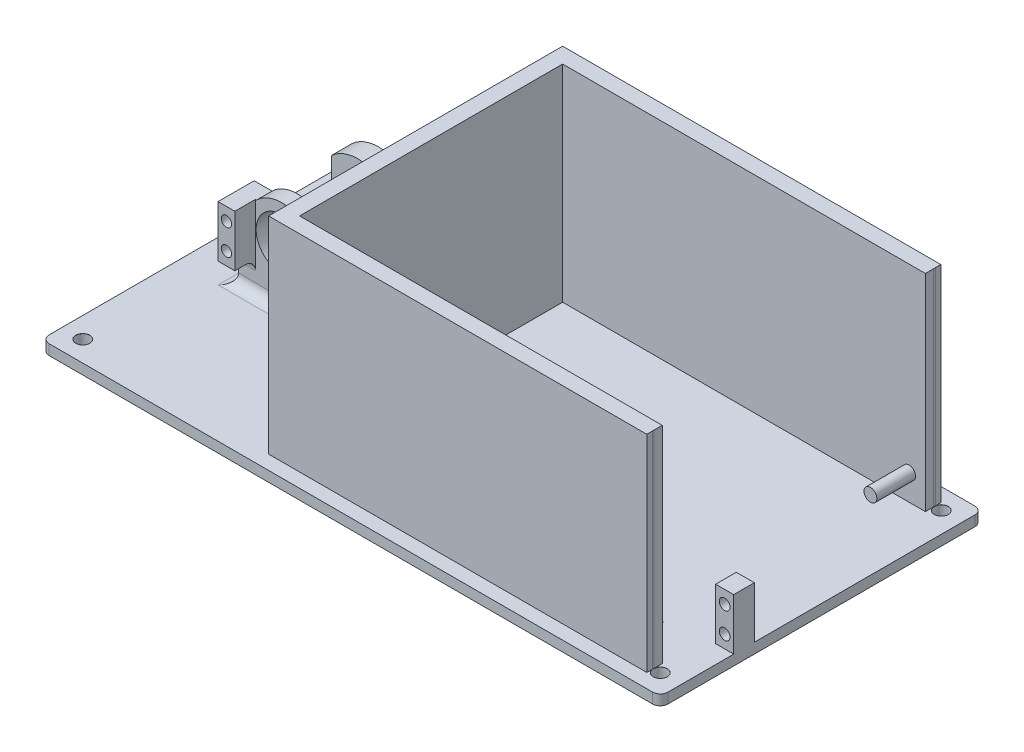
from build123d import *

# Parameters (mm, degrees)
SKETCH_1_W                        = 240
SKETCH_1_H                        = 125
EXTRUDE_1_DEPTH                   = 4
HOLE_WIZARD_5_4_5_4_1_D           = 5.4
HOLE_WIZARD_5_4_5_4_1_CSINK_D     = 5.45
HOLE_WIZARD_5_4_5_4_1_CSINK_ANGLE = 90
FILLET_1_R                        = 3
SKETCH_4_R                        = 10
EXTRUDE_2_DEPTH                   = 6
SKETCH_6_W                        = 6.5
SKETCH_6_H                        = 20
EXTRUDE_3_DEPTH                   = 8
SKETCH_7_R                        = 2
CUT_EXTRUDE_1_DEPTH               = 14
FILLET_2_R                        = 4
FILLET_3_R                        = 4
FILLET_4_R                        = 4
EXTRUDE_START                     = 23.5
EXTRUDE_4_DEPTH                   = 8
SKETCH_9_R                        = 5.5
EXTRUDE_5_DEPTH                   = 5
FILLET_5_R                        = 4
FILLET_6_R                        = 4
SKETCH_12_W                       = 7
SKETCH_12_H                       = 8
EXTRUDE_6_DEPTH                   = 20
CUT_EXTRUDE_2_REACH               = 161.108
SKETCH_13_R                       = 2.1
EXTRUDE_7_DEPTH                   = 80
SKETCH_15_R                       = 2.5
EXTRUDE_8_DEPTH                   = 4
EXTRUDE_START_2                   = 15
SKETCH_17_R                       = 2.5
EXTRUDE_9_DEPTH                   = 15


with BuildPart() as part:
    # 草图1 → 凸台-拉伸1 (new body)
    with BuildSketch(Plane(origin=(0, 0, 0), x_dir=(1, 0, 0), z_dir=(0, 1, 0))):
        Rectangle(SKETCH_1_W, SKETCH_1_H)
    extrude(amount=EXTRUDE_1_DEPTH)

    # Ø5.4 (5.4) 直径孔1 (through all)
    with Locations(Plane(origin=(0, 4, 0), x_dir=(1, 0, 0), z_dir=(0, 1, 0))):
        with Locations((112, 54.5), (-112, 54.5), (-112, -54.5), (112, -54.5)):
            CounterSinkHole(HOLE_WIZARD_5_4_5_4_1_D / 2, HOLE_WIZARD_5_4_5_4_1_CSINK_D / 2, counter_sink_angle=HOLE_WIZARD_5_4_5_4_1_CSINK_ANGLE)

    # 圆角1
    fillet_1_edges = [part.edges().sort_by_distance(p)[0] for p in [
        (120, 2, 62.5),
        (-120, 2, 62.5),
        (-120, 2, -62.5),
        (120, 2, -62.5),
    ]]
    fillet(fillet_1_edges, radius=FILLET_1_R)

    # 草图4 → 凸台-拉伸2 (add)
    with BuildSketch(Plane.XY):
        with BuildLine():
            Line((-100, 4), (-46, 4))
            Line((-46, 4), (-46, 36))
            Line((-46, 36), (-73.452041029, 36))
            ThreePointArc((-73.452041029, 36), (-83.25, 40), (-93.047958971, 36))
            Line((-93.047958971, 36), (-100, 36))
            Line((-100, 36), (-100, 4))
        make_face()
        with Locations((-83.25, 26)):
            Circle(SKETCH_4_R, mode=Mode.SUBTRACT)
    extrude(amount=EXTRUDE_2_DEPTH)

    # 草图6 → 凸台-拉伸3 (add)
    with BuildSketch(Plane.XY.offset(6)):
        with Locations((-96.75, 26)):
            Rectangle(SKETCH_6_W, SKETCH_6_H)
        with Locations((-49.25, 26)):
            Rectangle(SKETCH_6_W, SKETCH_6_H)
    extrude(amount=EXTRUDE_3_DEPTH)

    # 草图7 → 切除-拉伸1 (cut)
    with BuildSketch(Plane.XY.offset(14)):
        with Locations((-96.75, 31)):
            Circle(SKETCH_7_R)
        with Locations((-96.75, 21)):
            Circle(SKETCH_7_R)
        with Locations((-49.25, 21)):
            Circle(SKETCH_7_R)
        with Locations((-49.25, 31)):
            Circle(SKETCH_7_R)
    extrude(amount=-CUT_EXTRUDE_1_DEPTH, mode=Mode.SUBTRACT)

    # 圆角2
    fillet_2_edges = [part.edges().sort_by_distance(p)[0] for p in [
        (-49.25, 16, 6),
        (-96.75, 16, 6),
    ]]
    fillet(fillet_2_edges, radius=FILLET_2_R)

    # 圆角3
    fillet_3_edges = [part.edges().sort_by_distance(p)[0] for p in [
        (-73, 4, 6),
    ]]
    fillet(fillet_3_edges, radius=FILLET_3_R)

    # 圆角4
    fillet_4_edges = [part.edges().sort_by_distance(p)[0] for p in [
        (-73, 4, 0),
        (-100, 4, 5),
        (-46, 4, 5),
    ]]
    fillet(fillet_4_edges, radius=FILLET_4_R)

    # 草图8 → 凸台-拉伸4 (add)
    with BuildSketch(Plane(origin=(0, 0, 0), x_dir=(-1, 0, 0), z_dir=(0, 0, -1)).offset(EXTRUDE_START)):
        with BuildLine():
            Line((73, 8), (73, 36))
            ThreePointArc((73, 36), (83.25, 40), (93.5, 36))
            Line((93.5, 36), (93.5, 8))
            Line((93.5, 8), (93.5, 4))
            Line((93.5, 4), (73, 4))
            Line((73, 4), (73, 8))
        make_face()
    extrude(amount=EXTRUDE_4_DEPTH)

    # 草图9 → 凸台-拉伸5 (add)
    with BuildSketch(Plane.XY.offset(-23.5)):
        with Locations((-83.116793534, 25.812971514)):
            Circle(SKETCH_9_R)
    extrude(amount=EXTRUDE_5_DEPTH)

    # 圆角5
    fillet_5_edges = [part.edges().sort_by_distance(p)[0] for p in [
        (-83.25, 4, -31.5),
    ]]
    fillet(fillet_5_edges, radius=FILLET_5_R)

    # 圆角6
    fillet_6_edges = [part.edges().sort_by_distance(p)[0] for p in [
        (-73, 4, -29.5),
        (-83.25, 4, -23.5),
        (-93.5, 4, -29.5),
    ]]
    fillet(fillet_6_edges, radius=FILLET_6_R)

    # 草图12 → 凸台-拉伸6 (add)
    with BuildSketch(Plane(origin=(0, 4, 0), x_dir=(1, 0, 0), z_dir=(0, 1, 0))):
        with Locations((116.5, -30.016568117)):
            Rectangle(SKETCH_12_W, SKETCH_12_H)
        with Locations((69.5, -30.016568117)):
            Rectangle(SKETCH_12_W, SKETCH_12_H)
    extrude(amount=EXTRUDE_6_DEPTH)

    # 草图13 → 切除-拉伸2 (cut, up to next)
    with BuildSketch(Plane.XY.offset(34.016568117), mode=Mode.PRIVATE) as cut_extrude_2_sk1:
        with Locations((69.5, 19)):
            Circle(SKETCH_13_R)
    cut_extrude_2_tool1 = extrude(cut_extrude_2_sk1.sketch, amount=-CUT_EXTRUDE_2_REACH, mode=Mode.PRIVATE) & part.part
    # 草图13 → 切除-拉伸2 (cut, up to next)
    with BuildSketch(Plane.XY.offset(34.016568117), mode=Mode.PRIVATE) as cut_extrude_2_sk2:
        with Locations((69.5, 9)):
            Circle(SKETCH_13_R)
    cut_extrude_2_tool2 = extrude(cut_extrude_2_sk2.sketch, amount=-CUT_EXTRUDE_2_REACH, mode=Mode.PRIVATE) & part.part
    # 草图13 → 切除-拉伸2 (cut, up to next)
    with BuildSketch(Plane.XY.offset(34.016568117), mode=Mode.PRIVATE) as cut_extrude_2_sk3:
        with Locations((116.5, 9)):
            Circle(SKETCH_13_R)
    cut_extrude_2_tool3 = extrude(cut_extrude_2_sk3.sketch, amount=-CUT_EXTRUDE_2_REACH, mode=Mode.PRIVATE) & part.part
    # 草图13 → 切除-拉伸2 (cut, up to next)
    with BuildSketch(Plane.XY.offset(34.016568117), mode=Mode.PRIVATE) as cut_extrude_2_sk4:
        with Locations((116.5, 19)):
            Circle(SKETCH_13_R)
    cut_extrude_2_tool4 = extrude(cut_extrude_2_sk4.sketch, amount=-CUT_EXTRUDE_2_REACH, mode=Mode.PRIVATE) & part.part
    add(cut_extrude_2_tool1.solids().sort_by_distance((69.5, 19, 34.016568))[0], mode=Mode.SUBTRACT)
    add(cut_extrude_2_tool2.solids().sort_by_distance((69.5, 9, 34.016568))[0], mode=Mode.SUBTRACT)
    add(cut_extrude_2_tool3.solids().sort_by_distance((116.5, 9, 34.016568))[0], mode=Mode.SUBTRACT)
    add(cut_extrude_2_tool4.solids().sort_by_distance((116.5, 19, 34.016568))[0], mode=Mode.SUBTRACT)

    # 草图14 → 凸台-拉伸7 (add)
    with BuildSketch(Plane(origin=(0, 4, 0), x_dir=(1, 0, 0), z_dir=(0, 1, 0))):
        with BuildLine():
            Line((109.3, -51.016568117), (96.7, -51.016568117))
            Line((96.7, -51.016568117), (-31.378587674, -51.016568117))
            Line((-31.378587674, -51.016568117), (-31.378587674, 51.016568117))
            Line((-31.378587674, 51.016568117), (95.460915007, 51.016568117))
            Line((95.460915007, 51.016568117), (96.7, 51.016568117))
            Line((96.7, 51.016568117), (109.3, 51.016568117))
            Line((109.3, 51.016568117), (109.3, 54.131727003))
            ThreePointArc((109.3, 54.131727003), (109.275, 54.5), (109.3, 54.868272997))
            Line((109.3, 54.868272997), (109.3, 57.016568117))
            Line((109.3, 57.016568117), (-37.378587674, 57.016568117))
            Line((-37.378587674, 57.016568117), (-37.378587674, -50.764100258))
            Line((-37.378587674, -50.764100258), (-37.378587674, -57.016568117))
            Line((-37.378587674, -57.016568117), (109.3, -57.016568117))
            Line((109.3, -57.016568117), (109.3, -54.868272997))
            ThreePointArc((109.3, -54.868272997), (109.275, -54.5), (109.3, -54.131727003))
            Line((109.3, -54.131727003), (109.3, -51.016568117))
        make_face()
    extrude(amount=EXTRUDE_7_DEPTH)

    # 草图15 → 凸台-拉伸8 (add)
    with BuildSketch(Plane(origin=(0, 0, 51.016568117), x_dir=(-1, 0, 0), z_dir=(0, 0, -1))):
        with Locations((-103, 14)):
            Circle(SKETCH_15_R)
    extrude(amount=EXTRUDE_8_DEPTH)

    # 草图17 → 凸台-拉伸9 (add)
    with BuildSketch(Plane.XY.offset(-51.016568117).offset(EXTRUDE_START_2)):
        with Locations(Location((103, 14, 0), (0, 0, 180))):
            Circle(SKETCH_17_R)
    extrude(amount=-EXTRUDE_9_DEPTH)


solid = part.part
